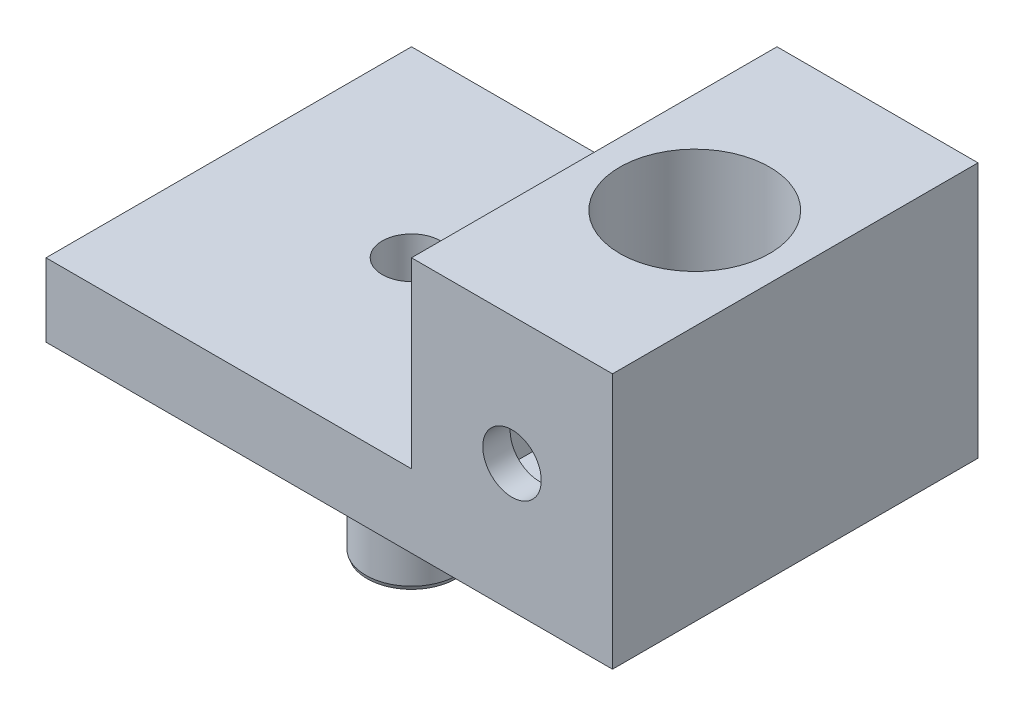
from build123d import *

# Parameters (mm, degrees)
EXTRUDE_1_DEPTH     = 20
HOLE_WIZARD_2_D     = 8.2
SKETCH_7_W          = 6
SKETCH_7_H          = 6
CUT_EXTRUDE_1_DEPTH = 1.5
HOLE_WIZARD_3_D     = 3.2
HOLE_WIZARD_3_DEPTH = 7
SKETCH_11_R         = 2.5
EXTRUDE_2_DEPTH     = 10
HOLE_WIZARD_4_D     = 3.2
SKETCH_14_R         = 2.8
EXTRUDE_3_DEPTH     = 0.6
CHAMFER_1_SIZE      = 0.2
CHAMFER_1_SIZE2     = 0.072794047
HOLE_WIZARD_5_D     = 3.2


with BuildPart() as part:
    # 草图1 → 凸台-拉伸1 (new body)
    with BuildSketch(Plane.XY):
        Polygon((0, 0), (20, 0), (20, 10), (31, 10), (31, -4), (0, -4), align=None)
    extrude(amount=EXTRUDE_1_DEPTH)

    # 孔2 (through all)
    with Locations(Plane(origin=(0, 10, 0), x_dir=(1, 0, 0), z_dir=(0, 1, 0))):
        with Locations((25.5, -10)):
            Hole(HOLE_WIZARD_2_D / 2)

    # 草图7 → 切除-拉伸1 (cut, symmetric)
    with BuildSketch(Plane.XY.offset(17)):
        with Locations((25.5, 3)):
            Rectangle(SKETCH_7_W, SKETCH_7_H)
    extrude(amount=CUT_EXTRUDE_1_DEPTH, both=True, mode=Mode.SUBTRACT)

    # 孔3
    with Locations(Plane.XY.offset(20)):
        with Locations((25.5, 3)):
            Hole(HOLE_WIZARD_3_D / 2, depth=HOLE_WIZARD_3_DEPTH)

    # 草图11 → 凸台-拉伸2 (add)
    with BuildSketch(Plane.XZ.offset(4)):
        with Locations(Location((10, 10, 0), (0, 0, 180))):
            Circle(SKETCH_11_R)
    extrude(amount=EXTRUDE_2_DEPTH)

    # 孔4 (through all)
    with Locations(Plane(origin=(0, -14, 0), x_dir=(-1, 0, 0), z_dir=(0, -1, 0))):
        with Locations((-10, -10)):
            Hole(HOLE_WIZARD_4_D / 2)

    # 草图14 → 凸台-拉伸3 (add)
    with BuildSketch(Plane.XZ.offset(4)):
        with Locations(Location((10, 10, 0), (0, 0, 180))):
            Circle(SKETCH_14_R)
    extrude(amount=EXTRUDE_3_DEPTH)

    # 倒角1
    chamfer_1_edges = [part.edges().sort_by_distance(p)[0] for p in [
        (12.5, -14, 10),
    ]]
    chamfer_1_side = [part.faces().sort_by_distance(p)[0] for p in [
        (12.5, -9.3, 10),
    ]]
    chamfer(chamfer_1_edges, length=CHAMFER_1_SIZE, length2=CHAMFER_1_SIZE2, reference=chamfer_1_side[0])

    # 孔5 (through all)
    with Locations(Plane(origin=(0, 0, 0), x_dir=(1, 0, 0), z_dir=(0, 1, 0))):
        with Locations((10, -10)):
            Hole(HOLE_WIZARD_5_D / 2)


solid = part.part
